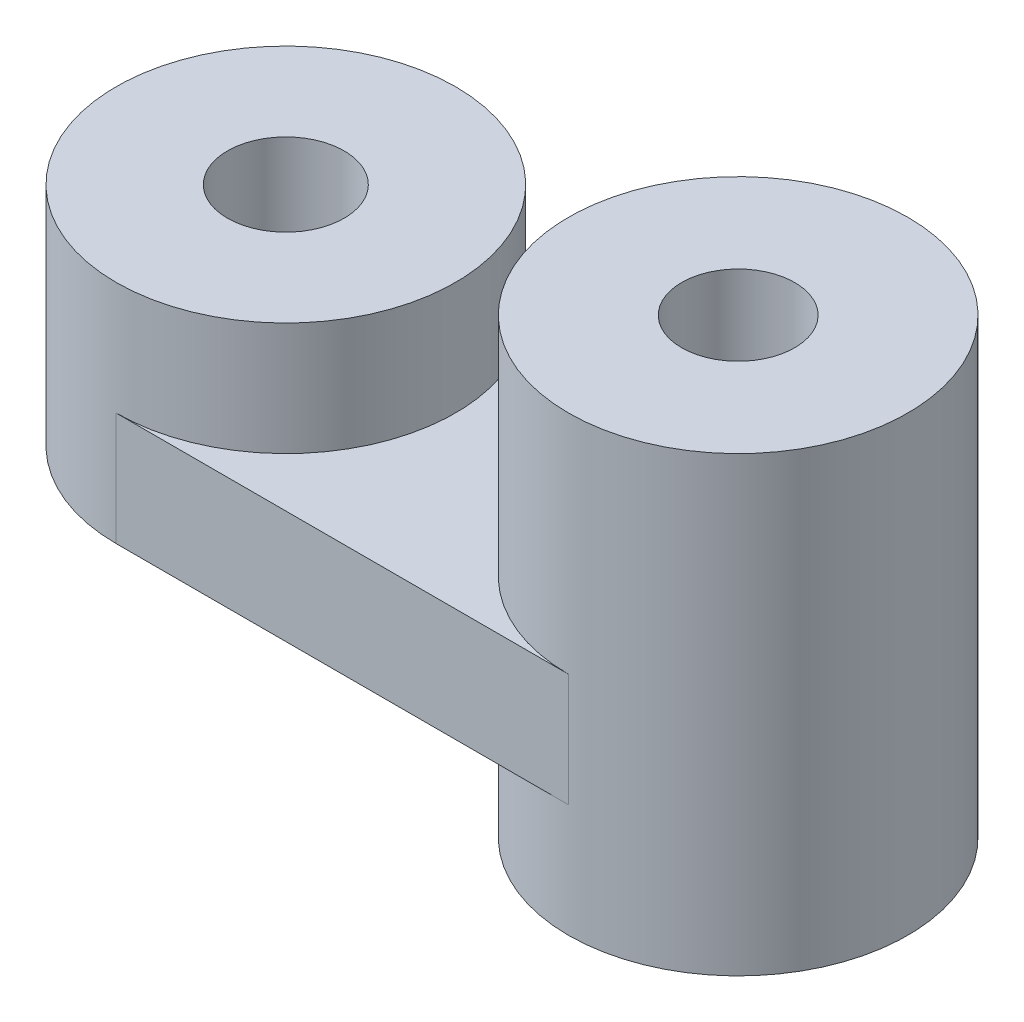
from build123d import *

# Parameters (mm, degrees)
CROQUIS1_R                   = 2.5
SALIENTE_EXTRUIR1_DEPTH      = 5
CROQUIS2_R                   = 7.5
CROQUIS2_R_2                 = 2.58081611
SALIENTE_EXTRUIR2_DEPTH      = 5
SALIENTE_EXTRUIR3_DEPTH      = 10
SALIENTE_EXTRUIR3_DEPTH_BACK = 10
CROQUIS3_R                   = 7.5
CROQUIS3_R_2                 = 2.5


with BuildPart() as part:
    # Croquis1 → Saliente-Extruir1 (new body)
    with BuildSketch(Plane(origin=(0, 0, 0), x_dir=(1, 0, 0), z_dir=(0, 1, 0))):
        with BuildLine():
            ThreePointArc((-10, 7.5), (-17.5, 0), (-10, -7.5))
            Line((-10, -7.5), (10, -7.5))
            ThreePointArc((10, -7.5), (17.5, 0), (10, 7.5))
            Line((10, 7.5), (-10, 7.5))
        make_face()
        with Locations(Location((-10, 0, 0), (0, 0, 270))):
            Circle(CROQUIS1_R, mode=Mode.SUBTRACT)
        with Locations(Location((10, 0, 0), (0, 0, 270))):
            Circle(CROQUIS1_R, mode=Mode.SUBTRACT)
    extrude(amount=SALIENTE_EXTRUIR1_DEPTH)

    # Croquis2 → Saliente-Extruir2 (add)
    with BuildSketch(Plane(origin=(0, 5, 0), x_dir=(1, 0, 0), z_dir=(0, 1, 0))):
        with Locations(Location((-10, 0, 0), (0, 0, 270))):
            Circle(CROQUIS2_R)
        with Locations(Location((-10, 0, 0), (0, 0, 270))):
            Circle(CROQUIS2_R_2, mode=Mode.SUBTRACT)
    extrude(amount=SALIENTE_EXTRUIR2_DEPTH)

    # Croquis3 → Saliente-Extruir3 (add, two sides: drawn at the far end of the back side and taken through both)
    with BuildSketch(Plane(origin=(0, 5, 0), x_dir=(1, 0, 0), z_dir=(0, 1, 0)).offset(-SALIENTE_EXTRUIR3_DEPTH_BACK)):
        with Locations(Location((10, 0, 0), (0, 0, 270))):
            Circle(CROQUIS3_R)
        with Locations(Location((10, 0, 0), (0, 0, 270))):
            Circle(CROQUIS3_R_2, mode=Mode.SUBTRACT)
    extrude(amount=SALIENTE_EXTRUIR3_DEPTH + SALIENTE_EXTRUIR3_DEPTH_BACK)


solid = part.part
